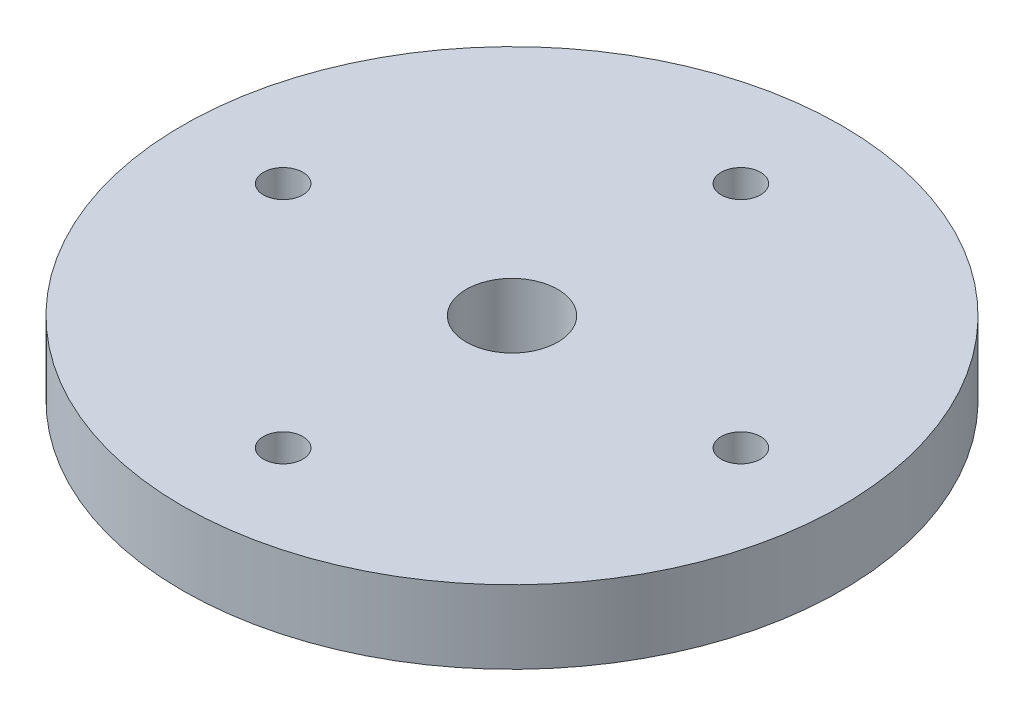
from build123d import *

# Parameters (mm, degrees)
SKETCH_1_R          = 36
EXTRUDE_1_DEPTH     = 8
SKETCH_2_R          = 2.15
SKETCH_2_R_2        = 5
CUT_EXTRUDE_1_DEPTH = 8


with BuildPart() as part:
    # 草图1 → 凸台-拉伸1 (new body)
    with BuildSketch(Plane(origin=(0, 0, 0), x_dir=(1, 0, 0), z_dir=(0, 1, 0))):
        with Locations(Location((0, 0, 0), (0, 0, 270))):
            Circle(SKETCH_1_R)
    extrude(amount=EXTRUDE_1_DEPTH)

    # 草图2 → 切除-拉伸1 (cut)
    with BuildSketch(Plane(origin=(0, 8, 0), x_dir=(1, 0, 0), z_dir=(0, 1, 0))):
        with Locations(Location((0, 25, 0), (0, 0, 270))):
            Circle(SKETCH_2_R)
        with Locations(Location((25, 0, 0), (0, 0, 270))):
            Circle(SKETCH_2_R)
        with Locations(Location((0, -25, 0), (0, 0, 270))):
            Circle(SKETCH_2_R)
        with Locations(Location((-25, 0, 0), (0, 0, 270))):
            Circle(SKETCH_2_R)
        with Locations(Location((0, 0, 0), (0, 0, 270))):
            Circle(SKETCH_2_R_2)
    extrude(amount=-CUT_EXTRUDE_1_DEPTH, mode=Mode.SUBTRACT)


solid = part.part
